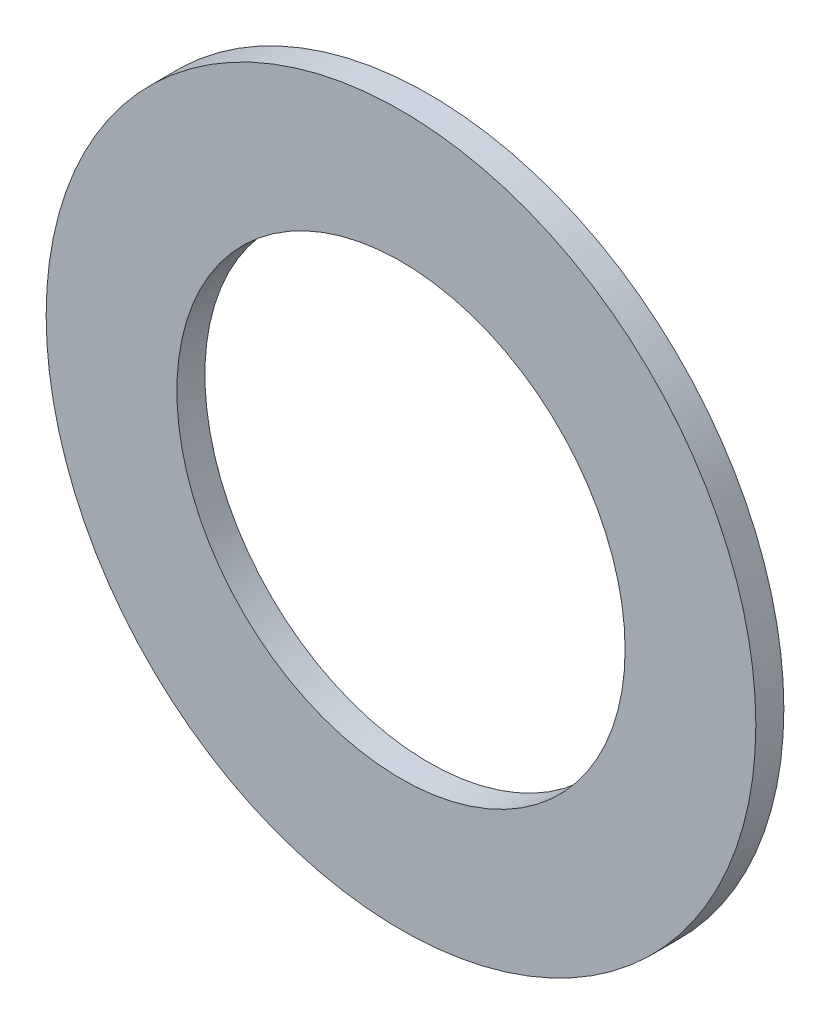
from build123d import *

# Parameters (mm, degrees)
SKETCH1_R           = 19
SKETCH1_R_2         = 12
BOSS_EXTRUDE1_DEPTH = 1.5


with BuildPart() as part:
    # Sketch1 → Boss-Extrude1 (new body)
    with BuildSketch(Plane.XY):
        Circle(SKETCH1_R)
        Circle(SKETCH1_R_2, mode=Mode.SUBTRACT)
    extrude(amount=BOSS_EXTRUDE1_DEPTH)


solid = part.part
